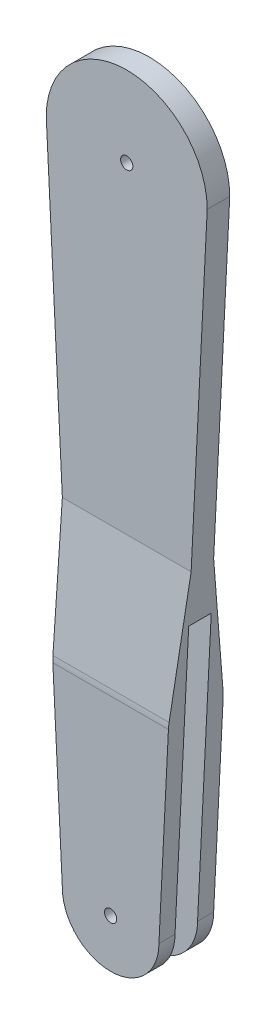
from build123d import *

# Parameters (mm, degrees)
BOSS_EXTRUDE1_DEPTH  = 7
SKETCH6_R            = 2.25
CUT_EXTRUDE4_DEPTH   = 25
BOSS_EXTRUDE2_START  = -21
BOSS_EXTRUDE2_DEPTH  = 43
CUT_EXTRUDE5_DEPTH   = 28
FILLET1_R            = 15
FILLET1_OF_MIRROR1_R = 15
SKETCH12_W           = 7
SKETCH12_H           = 100
CUT_EXTRUDE6_DEPTH   = 24.5
SKETCH13_R           = 1.9
CUT_EXTRUDE7_DEPTH   = 24.5
SKETCH14_R           = 1.9
CUT_EXTRUDE8_DEPTH   = 7


with BuildPart() as part:
    # Sketch2 → Boss-Extrude1 (new body)
    with BuildSketch(Plane.XY):
        with BuildLine():
            Line((15, -200), (25, 0))
            ThreePointArc((25, 0), (0, 25), (-25, 0))
            Line((-25, 0), (-15, -200))
            ThreePointArc((-15, -200), (0, -215), (15, -200))
        make_face()
    extrude(amount=BOSS_EXTRUDE1_DEPTH)

    # Sketch6 → Cut-Extrude4 (cut)
    with BuildSketch(Plane.XY.offset(7)):
        with Locations((0, -200)):
            Circle(SKETCH6_R)
    extrude(amount=-CUT_EXTRUDE4_DEPTH, mode=Mode.SUBTRACT)

    # Sketch9 → Boss-Extrude2 (add)
    with BuildSketch(Plane.ZY.offset(BOSS_EXTRUDE2_START)):
        Polygon((0, -200), (0, -215), (-5, -215), (-5, -140), (0, -100), align=None)
    boss_extrude2 = extrude(amount=BOSS_EXTRUDE2_DEPTH)

    # Sketch10 → Cut-Extrude5 (cut, symmetric)
    with BuildSketch(Plane.XY.offset(7)):
        with BuildLine():
            Line((21, -100), (20, -100))
            Line((20, -100), (15, -200))
            ThreePointArc((15, -200), (10.606601767, -210.606601669), (1.38e-07, -215))
            Line((1.38e-07, -215), (21, -215))
            Line((21, -215), (21, -100))
        make_face()
        with BuildLine():
            Line((-22, -215), (1.38e-07, -215))
            ThreePointArc((1.38e-07, -215), (-10.606601669, -210.606601767), (-15, -200))
            Line((-15, -200), (-20, -100))
            Line((-20, -100), (-22, -100))
            Line((-22, -100), (-22, -215))
        make_face()
    cut_extrude5 = extrude(amount=CUT_EXTRUDE5_DEPTH, both=True, mode=Mode.SUBTRACT)

    # Fillet1
    fillet1_edges = [part.edges().sort_by_distance(p)[0] for p in [
        (0, -140, -5),
    ]]
    fillet(fillet1_edges, radius=FILLET1_R)

    # Mirror1: Boss-Extrude2 across plane
    add(boss_extrude2.mirror(Plane.XY.offset(3.5)))

    # Fillet1 of Mirror1
    fillet1_of_mirror1_edges = [part.edges().sort_by_distance(p)[0] for p in [
        (0, -140, 12),
    ]]
    fillet(fillet1_of_mirror1_edges, radius=FILLET1_OF_MIRROR1_R)

    # Mirror2: Cut-Extrude5 across plane
    add(cut_extrude5.mirror(Plane.XY.offset(3.5)), mode=Mode.SUBTRACT)

    # Sketch12 → Cut-Extrude6 (cut, symmetric)
    with BuildSketch(Plane.ZY):
        with Locations((3.5, -165)):
            Rectangle(SKETCH12_W, SKETCH12_H)
    extrude(amount=CUT_EXTRUDE6_DEPTH, both=True, mode=Mode.SUBTRACT)

    # Sketch13 → Cut-Extrude7 (cut, symmetric)
    with BuildSketch(Plane(origin=(0, 0, -5), x_dir=(-1, 0, 0), z_dir=(0, 0, -1))):
        with Locations(Location((0, -200, 0), (0, 0, 90))):
            Circle(SKETCH13_R)
    extrude(amount=CUT_EXTRUDE7_DEPTH, both=True, mode=Mode.SUBTRACT)

    # Sketch14 → Cut-Extrude8 (cut)
    with BuildSketch(Plane(origin=(0, 0, 0), x_dir=(-1, 0, 0), z_dir=(0, 0, -1))):
        Circle(SKETCH14_R)
    extrude(amount=-CUT_EXTRUDE8_DEPTH, mode=Mode.SUBTRACT)


solid = part.part
